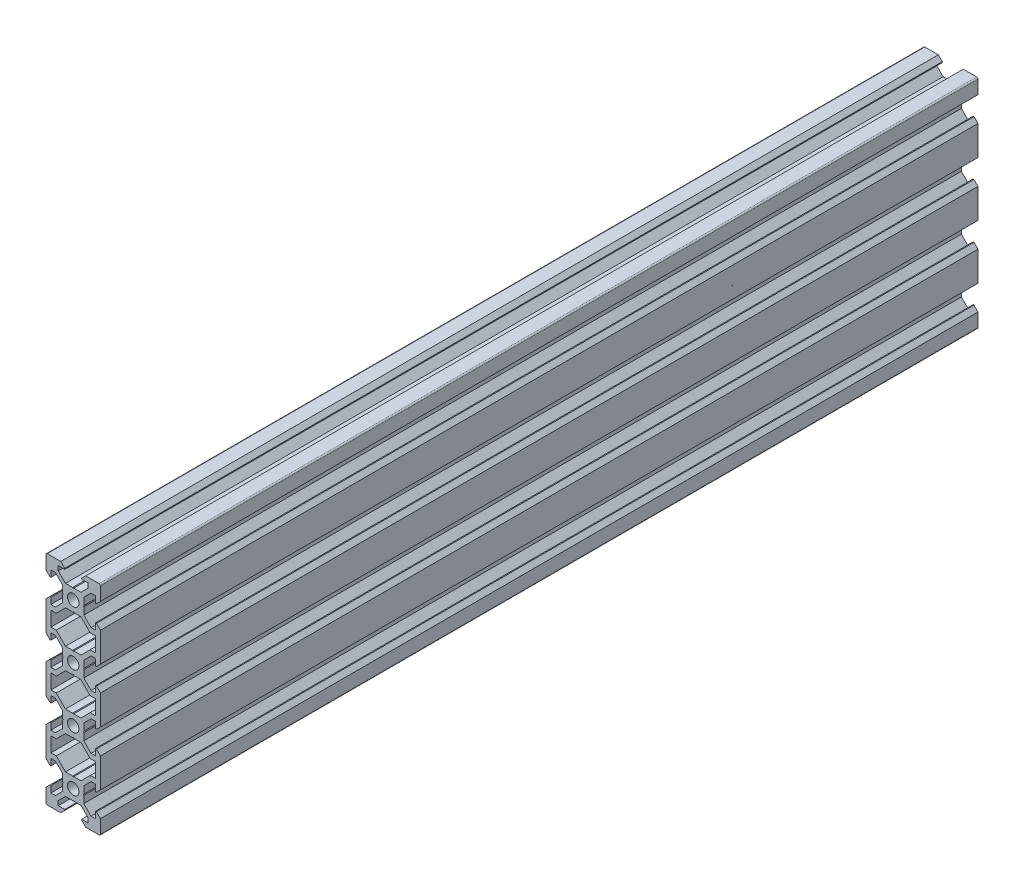
from build123d import *

# Parameters (mm, degrees)
BOSS_EXTRU_1_DEPTH = 322.5


with BuildPart() as part:
    # Esquisse1 → Boss.-Extru.1 (new body)
    with BuildSketch(Plane.XY):
        with BuildLine():
            Line((-9.5, 10), (-4.58, 10))
            Line((-4.58, 10), (-3.125, 8.545))
            Line((-3.125, 8.545), (-3.125, 8.2))
            Line((-3.125, 8.2), (-5.5, 8.2))
            Line((-5.5, 8.2), (-5.5, 6.560660172))
            Line((-5.5, 6.560660172), (-2.839339828, 3.9))
            Line((-2.839339828, 3.9), (-0.21, 3.9))
            Line((-0.21, 3.9), (0, 3.69))
            Line((0, 3.69), (0, 2.1))
            ThreePointArc((0, 2.1), (-2.1, 0), (0, -2.1))
            Line((0, -2.1), (0, -3.69))
            Line((0, -3.69), (-0.21, -3.9))
            Line((-0.21, -3.9), (-2.839339828, -3.9))
            Line((-2.839339828, -3.9), (-6.239339828, -7.3))
            Line((-6.239339828, -7.3), (-8.2, -7.3))
            Line((-8.2, -7.3), (-8.2, -12.7))
            Line((-8.2, -12.7), (-6.239339828, -12.7))
            Line((-6.239339828, -12.7), (-2.839339828, -16.1))
            Line((-2.839339828, -16.1), (-0.21, -16.1))
            Line((-0.21, -16.1), (0, -16.31))
            Line((0, -16.31), (0, -17.9))
            ThreePointArc((0, -17.9), (-2.1, -20), (0, -22.1))
            Line((0, -22.1), (0, -23.69))
            Line((0, -23.69), (-0.21, -23.9))
            Line((-0.21, -23.9), (-2.839339828, -23.9))
            Line((-2.839339828, -23.9), (-6.239339828, -27.3))
            Line((-6.239339828, -27.3), (-8.2, -27.3))
            Line((-8.2, -27.3), (-8.2, -32.7))
            Line((-8.2, -32.7), (-6.239339828, -32.7))
            Line((-6.239339828, -32.7), (-2.839339828, -36.1))
            Line((-2.839339828, -36.1), (-0.21, -36.1))
            Line((-0.21, -36.1), (0, -36.31))
            Line((0, -36.31), (0, -37.9))
            ThreePointArc((0, -37.9), (-2.1, -40), (0, -42.1))
            Line((0, -42.1), (0, -43.69))
            Line((0, -43.69), (-0.21, -43.9))
            Line((-0.21, -43.9), (-2.839339828, -43.9))
            Line((-2.839339828, -43.9), (-6.239339828, -47.3))
            Line((-6.239339828, -47.3), (-8.2, -47.3))
            Line((-8.2, -47.3), (-8.2, -52.7))
            Line((-8.2, -52.7), (-6.239339828, -52.7))
            Line((-6.239339828, -52.7), (-2.839339828, -56.1))
            Line((-2.839339828, -56.1), (-0.21, -56.1))
            Line((-0.21, -56.1), (0, -56.31))
            Line((0, -56.31), (0, -57.9))
            ThreePointArc((0, -57.9), (-2.1, -60), (0, -62.1))
            Line((0, -62.1), (0, -63.69))
            Line((0, -63.69), (-0.21, -63.9))
            Line((-0.21, -63.9), (-2.839339828, -63.9))
            Line((-2.839339828, -63.9), (-5.5, -66.560660172))
            Line((-5.5, -66.560660172), (-5.5, -68.2))
            Line((-5.5, -68.2), (-3.125, -68.2))
            Line((-3.125, -68.2), (-3.125, -68.545))
            Line((-3.125, -68.545), (-4.58, -70))
            Line((-4.58, -70), (-9.5, -70))
            ThreePointArc((-9.5, -70), (-9.853553391, -69.853553391), (-10, -69.5))
            Line((-10, -69.5), (-10, -64.58))
            Line((-10, -64.58), (-8.545, -63.125))
            Line((-8.545, -63.125), (-8.2, -63.125))
            Line((-8.2, -63.125), (-8.2, -65.5))
            Line((-8.2, -65.5), (-6.560660172, -65.5))
            Line((-6.560660172, -65.5), (-3.9, -62.839339828))
            Line((-3.9, -62.839339828), (-3.9, -60.21))
            Line((-3.9, -60.21), (-3.69, -60))
            Line((-3.69, -60), (-3.9, -59.79))
            Line((-3.9, -59.79), (-3.9, -57.160660172))
            Line((-3.9, -57.160660172), (-6.560660172, -54.5))
            Line((-6.560660172, -54.5), (-8.2, -54.5))
            Line((-8.2, -54.5), (-8.2, -56.875))
            Line((-8.2, -56.875), (-8.545, -56.875))
            Line((-8.545, -56.875), (-10, -55.42))
            Line((-10, -55.42), (-10, -44.58))
            Line((-10, -44.58), (-8.545, -43.125))
            Line((-8.545, -43.125), (-8.2, -43.125))
            Line((-8.2, -43.125), (-8.2, -45.5))
            Line((-8.2, -45.5), (-6.560660172, -45.5))
            Line((-6.560660172, -45.5), (-3.9, -42.839339828))
            Line((-3.9, -42.839339828), (-3.9, -40.21))
            Line((-3.9, -40.21), (-3.69, -40))
            Line((-3.69, -40), (-3.9, -39.79))
            Line((-3.9, -39.79), (-3.9, -37.160660172))
            Line((-3.9, -37.160660172), (-6.560660172, -34.5))
            Line((-6.560660172, -34.5), (-8.2, -34.5))
            Line((-8.2, -34.5), (-8.2, -36.875))
            Line((-8.2, -36.875), (-8.545, -36.875))
            Line((-8.545, -36.875), (-10, -35.42))
            Line((-10, -35.42), (-10, -24.58))
            Line((-10, -24.58), (-8.545, -23.125))
            Line((-8.545, -23.125), (-8.2, -23.125))
            Line((-8.2, -23.125), (-8.2, -25.5))
            Line((-8.2, -25.5), (-6.560660172, -25.5))
            Line((-6.560660172, -25.5), (-3.9, -22.839339828))
            Line((-3.9, -22.839339828), (-3.9, -20.21))
            Line((-3.9, -20.21), (-3.69, -20))
            Line((-3.69, -20), (-3.9, -19.79))
            Line((-3.9, -19.79), (-3.9, -17.160660172))
            Line((-3.9, -17.160660172), (-6.560660172, -14.5))
            Line((-6.560660172, -14.5), (-8.2, -14.5))
            Line((-8.2, -14.5), (-8.2, -16.875))
            Line((-8.2, -16.875), (-8.545, -16.875))
            Line((-8.545, -16.875), (-10, -15.42))
            Line((-10, -15.42), (-10, -4.58))
            Line((-10, -4.58), (-8.545, -3.125))
            Line((-8.545, -3.125), (-8.2, -3.125))
            Line((-8.2, -3.125), (-8.2, -5.5))
            Line((-8.2, -5.5), (-6.560660172, -5.5))
            Line((-6.560660172, -5.5), (-3.9, -2.839339828))
            Line((-3.9, -2.839339828), (-3.9, -0.21))
            Line((-3.9, -0.21), (-3.69, 0))
            Line((-3.69, 0), (-3.9, 0.21))
            Line((-3.9, 0.21), (-3.9, 2.839339828))
            Line((-3.9, 2.839339828), (-6.560660172, 5.5))
            Line((-6.560660172, 5.5), (-8.2, 5.5))
            Line((-8.2, 5.5), (-8.2, 3.125))
            Line((-8.2, 3.125), (-8.545, 3.125))
            Line((-8.545, 3.125), (-10, 4.58))
            Line((-10, 4.58), (-10, 9.5))
            ThreePointArc((-10, 9.5), (-9.853553391, 9.853553391), (-9.5, 10))
        make_face()
    boss_extru_1 = extrude(amount=BOSS_EXTRU_1_DEPTH)

    # Symétrie1: Boss.-Extru.1 across plane
    add(boss_extru_1.mirror(Plane(origin=(0, 3.69, 322.5), x_dir=(0, 0, 1), z_dir=(-1, 0, 0))))


solid = part.part
